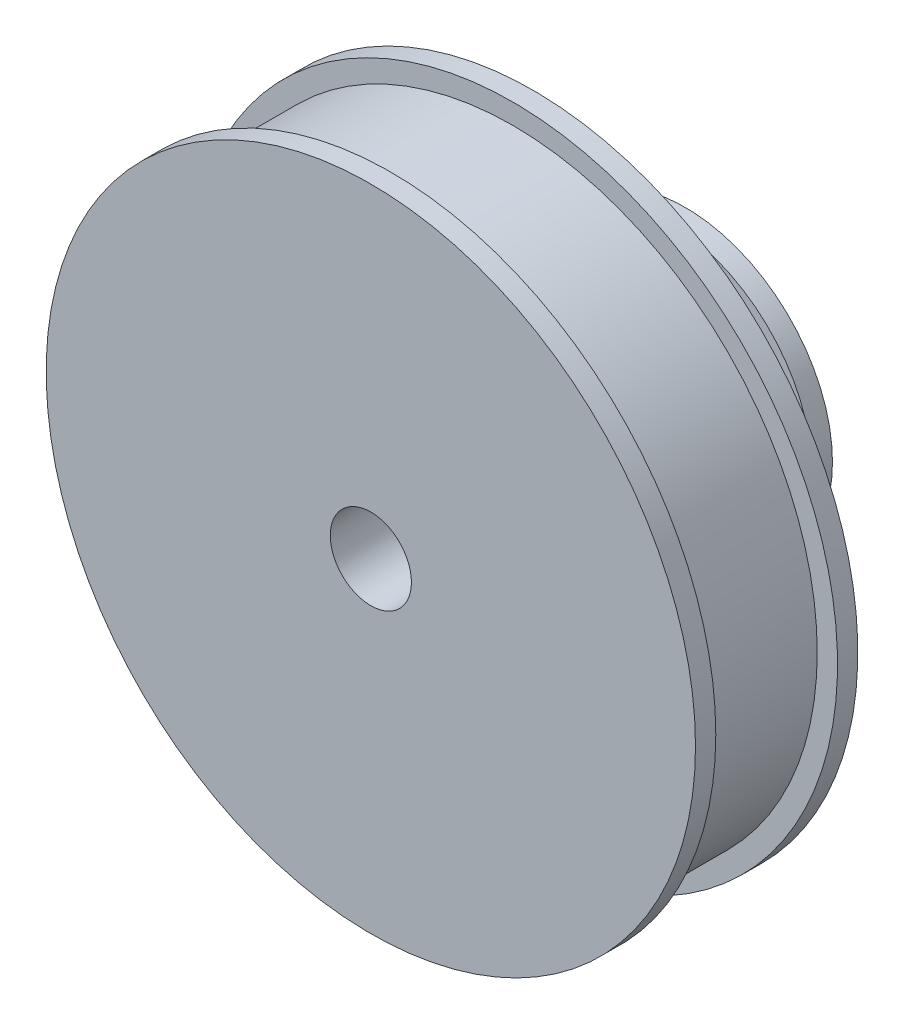
from build123d import *

# Parameters (mm, degrees)
SKETCH_1_R          = 12.5
EXTRUDE_1_DEPTH     = 15
SKETCH_2_R          = 30
EXTRUDE_2_DEPTH     = 14
SKETCH_3_R          = 32
EXTRUDE_3_DEPTH     = 2
SKETCH_4_R          = 32
EXTRUDE_4_DEPTH     = 2
SKETCH_5_R          = 14.5
EXTRUDE_5_DEPTH     = 2
SKETCH_6_R          = 4
CUT_EXTRUDE_1_DEPTH = 55.854352608


with BuildPart() as part:
    # 草图1 → 拉伸1 (new body)
    with BuildSketch(Plane.XY):
        Circle(SKETCH_1_R)
    extrude(amount=EXTRUDE_1_DEPTH)

    # 草图2 → 拉伸2 (add)
    with BuildSketch(Plane.XY.offset(15)):
        Circle(SKETCH_2_R)
    extrude(amount=EXTRUDE_2_DEPTH)

    # 草图3 → 拉伸3 (add)
    with BuildSketch(Plane.XY.offset(29)):
        Circle(SKETCH_3_R)
    extrude(amount=-EXTRUDE_3_DEPTH)

    # 草图4 → 拉伸4 (add)
    with BuildSketch(Plane(origin=(0, 0, 15), x_dir=(-1, 0, 0), z_dir=(0, 0, -1))):
        with Locations(Location((0, 0, 0), (0, 0, 180))):
            Circle(SKETCH_4_R)
    extrude(amount=EXTRUDE_4_DEPTH)

    # 草图5 → 拉伸5 (add)
    with BuildSketch(Plane(origin=(0, 0, 0), x_dir=(-1, 0, 0), z_dir=(0, 0, -1))):
        Circle(SKETCH_5_R)
    extrude(amount=EXTRUDE_5_DEPTH)

    # 草图6 → 切除-拉伸1 (cut, through all)
    with BuildSketch(Plane.XY.offset(29)):
        Circle(SKETCH_6_R)
    extrude(amount=-CUT_EXTRUDE_1_DEPTH, mode=Mode.SUBTRACT)


solid = part.part
